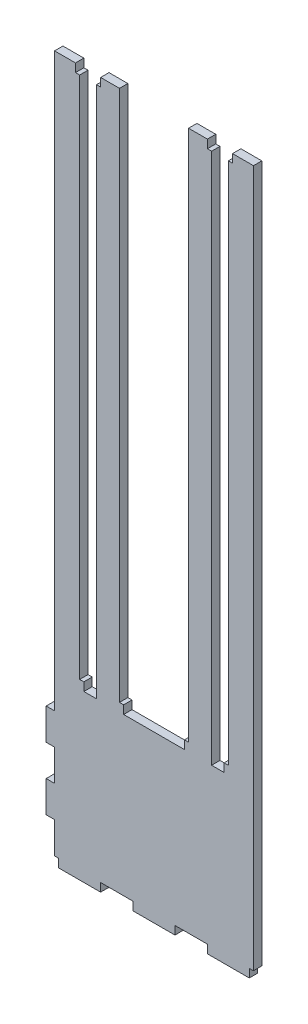
from build123d import *

# Parameters (mm, degrees)
SKETCH1_W           = 95
SKETCH1_H           = 75
BOSS_EXTRUDE1_DEPTH = 2
SKETCH2_W           = 14
SKETCH2_H           = 4
SKETCH2_W_2         = 13
BOSS_EXTRUDE2_DEPTH = 4
SKETCH3_W           = 12
SKETCH3_H           = 4
SKETCH3_W_2         = 11
BOSS_EXTRUDE3_DEPTH = 250
SKETCH4_W           = 10
SKETCH4_H           = 4
SKETCH4_W_2         = 9
BOSS_EXTRUDE4_DEPTH = 4
SKETCH5_W           = 4
SKETCH5_H           = 15
BOSS_EXTRUDE5_DEPTH = 4
SKETCH6_W           = 20
SKETCH6_H           = 4
BOSS_EXTRUDE6_DEPTH = 4


with BuildPart() as part:
    # Sketch1 → Boss-Extrude1 (new, symmetric)
    with BuildSketch(Plane.XY):
        Rectangle(SKETCH1_W, SKETCH1_H)
    extrude(amount=BOSS_EXTRUDE1_DEPTH, both=True)

    # Sketch2 → Boss-Extrude2 (add)
    with BuildSketch(Plane(origin=(0, 37.5, 0), x_dir=(1, 0, 0), z_dir=(0, 1, 0))):
        with Locations((40.5, 0)):
            Rectangle(SKETCH2_W, SKETCH2_H)
        with Locations((21, 0)):
            Rectangle(SKETCH2_W_2, SKETCH2_H)
        with Locations((-40.5, 0)):
            Rectangle(SKETCH2_W, SKETCH2_H)
        with Locations((-21, 0)):
            Rectangle(SKETCH2_W_2, SKETCH2_H)
    extrude(amount=BOSS_EXTRUDE2_DEPTH)

    # Sketch3 → Boss-Extrude3 (add)
    with BuildSketch(Plane(origin=(0, 41.5, 0), x_dir=(1, 0, 0), z_dir=(0, 1, 0))):
        with Locations((41.5, 0)):
            Rectangle(SKETCH3_W, SKETCH3_H)
        with Locations((22, 0)):
            Rectangle(SKETCH3_W_2, SKETCH3_H)
        with Locations((-22, 0)):
            Rectangle(SKETCH3_W_2, SKETCH3_H)
        with Locations((-41.5, 0)):
            Rectangle(SKETCH3_W, SKETCH3_H)
    extrude(amount=BOSS_EXTRUDE3_DEPTH)

    # Sketch4 → Boss-Extrude4 (add)
    with BuildSketch(Plane(origin=(0, 291.5, 0), x_dir=(1, 0, 0), z_dir=(0, 1, 0))):
        with Locations((-42.5, 0)):
            Rectangle(SKETCH4_W, SKETCH4_H)
        with Locations((-21, 0)):
            Rectangle(SKETCH4_W_2, SKETCH4_H)
        with Locations((21, 0)):
            Rectangle(SKETCH4_W_2, SKETCH4_H)
        with Locations((42.5, 0)):
            Rectangle(SKETCH4_W, SKETCH4_H)
    extrude(amount=BOSS_EXTRUDE4_DEPTH)

    # Sketch5 → Boss-Extrude5 (add)
    with BuildSketch(Plane.ZY.offset(47.5)):
        with Locations((0, -15)):
            Rectangle(SKETCH5_W, SKETCH5_H)
        with Locations((0, 15)):
            Rectangle(SKETCH5_W, SKETCH5_H)
    extrude(amount=BOSS_EXTRUDE5_DEPTH)

    # Sketch6 → Boss-Extrude6 (add)
    with BuildSketch(Plane.XZ.offset(37.5)):
        with Locations((-35.5, 0)):
            Rectangle(SKETCH6_W, SKETCH6_H)
        with Locations((35.5, 0)):
            Rectangle(SKETCH6_W, SKETCH6_H)
        Rectangle(SKETCH6_W, SKETCH6_H)
    extrude(amount=BOSS_EXTRUDE6_DEPTH)


solid = part.part
